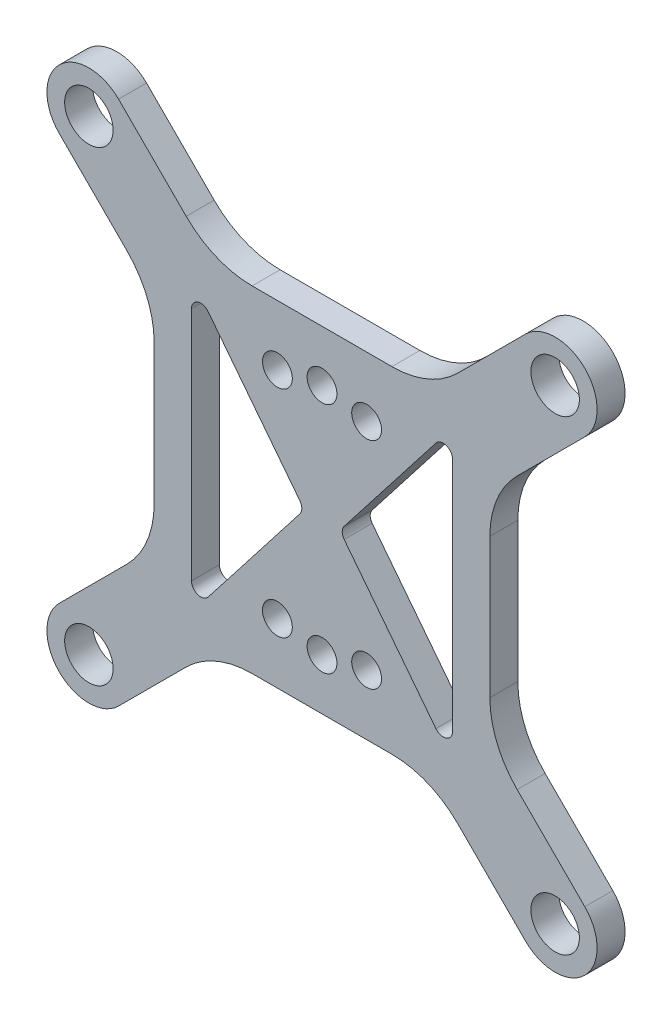
from build123d import *

# Parameters (mm, degrees)
SKETCH_1_R          = 2.6
EXTRUDE_1_DEPTH     = 3
SKETCH_2_W          = 36
SKETCH_2_H          = 36
EXTRUDE_2_DEPTH     = 3
CUT_EXTRUDE_1_REACH = 43.827
SKETCH_3_R          = 1.6
CUT_EXTRUDE_2_DEPTH = 3
FILLET_1_R          = 1
FILLET_2_R          = 10


with BuildPart() as part:
    # 草图1 → 凸台-拉伸1 (new body)
    # profile 1 of 5: a face of its own
    with BuildSketch(Plane.XY):
        with BuildLine():
            Line((-28.181980515, 21.818019485), (-6.363961031, 0))
            Line((-6.363961031, 0), (0, 6.363961031))
            Line((0, 6.363961031), (-21.818019485, 28.181980515))
            ThreePointArc((-21.818019485, 28.181980515), (-28.181980515, 28.181980515), (-28.181980515, 21.818019485))
        make_face()
        with Locations((-25, 25)):
            Circle(SKETCH_1_R, mode=Mode.SUBTRACT)
    # profile 2 of 5: a face of its own
    with BuildSketch(Plane.XY):
        with BuildLine():
            Line((-6.363961031, 0), (-28.181980515, -21.818019485))
            ThreePointArc((-28.181980515, -21.818019485), (-28.181980515, -28.181980515), (-21.818019485, -28.181980515))
            Line((-21.818019485, -28.181980515), (0, -6.363961031))
            Line((0, -6.363961031), (-6.363961031, 0))
        make_face()
        with Locations((-25, -25)):
            Circle(SKETCH_1_R, mode=Mode.SUBTRACT)
    # profile 3 of 5: a face of its own
    with BuildSketch(Plane.XY):
        with BuildLine():
            Line((6.363961031, 0), (0, -6.363961031))
            Line((0, -6.363961031), (21.818019485, -28.181980515))
            ThreePointArc((21.818019485, -28.181980515), (28.181980515, -28.181980515), (28.181980515, -21.818019485))
            Line((28.181980515, -21.818019485), (6.363961031, 0))
        make_face()
        with Locations((25, -25)):
            Circle(SKETCH_1_R, mode=Mode.SUBTRACT)
    # profile 4 of 5: a face of its own
    with BuildSketch(Plane.XY):
        with BuildLine():
            Line((21.818019485, 28.181980515), (0, 6.363961031))
            Line((0, 6.363961031), (6.363961031, 0))
            Line((6.363961031, 0), (28.181980515, 21.818019485))
            ThreePointArc((28.181980515, 21.818019485), (28.181980515, 28.181980515), (21.818019485, 28.181980515))
        make_face()
        with Locations((25, 25)):
            Circle(SKETCH_1_R, mode=Mode.SUBTRACT)
    # profile 5 of 5: a face of its own
    with BuildSketch(Plane.XY):
        Polygon((0, 6.363961031), (-6.363961031, 0), (0, -6.363961031), (6.363961031, 0), align=None)
    extrude(amount=EXTRUDE_1_DEPTH)

    # 草图2 → 凸台-拉伸2 (add)
    with BuildSketch(Plane.XY.offset(3)):
        Rectangle(SKETCH_2_W, SKETCH_2_H)
    extrude(amount=-EXTRUDE_2_DEPTH)

    # 草图3 → 切除-拉伸1 (cut, up to next)
    with BuildSketch(Plane.XY.offset(3), mode=Mode.PRIVATE) as cut_extrude_1_sk1:
        with Locations((0, -12.5)):
            Circle(SKETCH_3_R)
    cut_extrude_1_tool1 = extrude(cut_extrude_1_sk1.sketch, amount=-CUT_EXTRUDE_1_REACH, mode=Mode.PRIVATE) & part.part
    # 草图3 → 切除-拉伸1 (cut, up to next)
    with BuildSketch(Plane.XY.offset(3), mode=Mode.PRIVATE) as cut_extrude_1_sk2:
        with Locations((0, 12.5)):
            Circle(SKETCH_3_R)
    cut_extrude_1_tool2 = extrude(cut_extrude_1_sk2.sketch, amount=-CUT_EXTRUDE_1_REACH, mode=Mode.PRIVATE) & part.part
    # 草图3 → 切除-拉伸1 (cut, up to next)
    with BuildSketch(Plane.XY.offset(3), mode=Mode.PRIVATE) as cut_extrude_1_sk3:
        with Locations((4.783542905, 11.548494156)):
            Circle(SKETCH_3_R)
    cut_extrude_1_tool3 = extrude(cut_extrude_1_sk3.sketch, amount=-CUT_EXTRUDE_1_REACH, mode=Mode.PRIVATE) & part.part
    # 草图3 → 切除-拉伸1 (cut, up to next)
    with BuildSketch(Plane.XY.offset(3), mode=Mode.PRIVATE) as cut_extrude_1_sk4:
        with Locations((-4.783542905, -11.548494156)):
            Circle(SKETCH_3_R)
    cut_extrude_1_tool4 = extrude(cut_extrude_1_sk4.sketch, amount=-CUT_EXTRUDE_1_REACH, mode=Mode.PRIVATE) & part.part
    # 草图3 → 切除-拉伸1 (cut, up to next)
    with BuildSketch(Plane.XY.offset(3), mode=Mode.PRIVATE) as cut_extrude_1_sk5:
        with Locations((4.783542905, -11.548494156)):
            Circle(SKETCH_3_R)
    cut_extrude_1_tool5 = extrude(cut_extrude_1_sk5.sketch, amount=-CUT_EXTRUDE_1_REACH, mode=Mode.PRIVATE) & part.part
    # 草图3 → 切除-拉伸1 (cut, up to next)
    with BuildSketch(Plane.XY.offset(3), mode=Mode.PRIVATE) as cut_extrude_1_sk6:
        with Locations((-4.783542905, 11.548494156)):
            Circle(SKETCH_3_R)
    cut_extrude_1_tool6 = extrude(cut_extrude_1_sk6.sketch, amount=-CUT_EXTRUDE_1_REACH, mode=Mode.PRIVATE) & part.part
    add(cut_extrude_1_tool1.solids().sort_by_distance((0, -12.5, 3))[0], mode=Mode.SUBTRACT)
    add(cut_extrude_1_tool2.solids().sort_by_distance((0, 12.5, 3))[0], mode=Mode.SUBTRACT)
    add(cut_extrude_1_tool3.solids().sort_by_distance((4.783543, 11.548494, 3))[0], mode=Mode.SUBTRACT)
    add(cut_extrude_1_tool4.solids().sort_by_distance((-4.783543, -11.548494, 3))[0], mode=Mode.SUBTRACT)
    add(cut_extrude_1_tool5.solids().sort_by_distance((4.783543, -11.548494, 3))[0], mode=Mode.SUBTRACT)
    add(cut_extrude_1_tool6.solids().sort_by_distance((-4.783543, 11.548494, 3))[0], mode=Mode.SUBTRACT)

    # 草图4 → 切除-拉伸2 (cut)
    with BuildSketch(Plane.XY.offset(3)):
        Polygon((14, -15.556766946), (14, 15.556766946), (1.900292375, 0), align=None)
        Polygon((-14, -15.556766946), (-1.900292375, 0), (-14, 15.556766946), align=None)
    extrude(amount=-CUT_EXTRUDE_2_DEPTH, mode=Mode.SUBTRACT)

    # 圆角1
    fillet_1_edges = [part.edges().sort_by_distance(p)[0] for p in [
        (14, 15.556766946, 1.5),
        (14, -15.556766946, 1.5),
        (1.900292375, 0, 1.5),
        (-14, -15.556766946, 1.5),
        (-14, 15.556766946, 1.5),
        (-1.900292375, 0, 1.5),
    ]]
    fillet(fillet_1_edges, radius=FILLET_1_R)

    # 圆角2
    fillet_2_edges = [part.edges().sort_by_distance(p)[0] for p in [
        (18, -11.636038969, 1.5),
        (-11.636038969, -18, 1.5),
        (-18, -11.636038969, 1.5),
        (18, 11.636038969, 1.5),
        (11.636038969, -18, 1.5),
        (-18, 11.636038969, 1.5),
        (-11.636038969, 18, 1.5),
        (11.636038969, 18, 1.5),
    ]]
    fillet(fillet_2_edges, radius=FILLET_2_R)


solid = part.part
